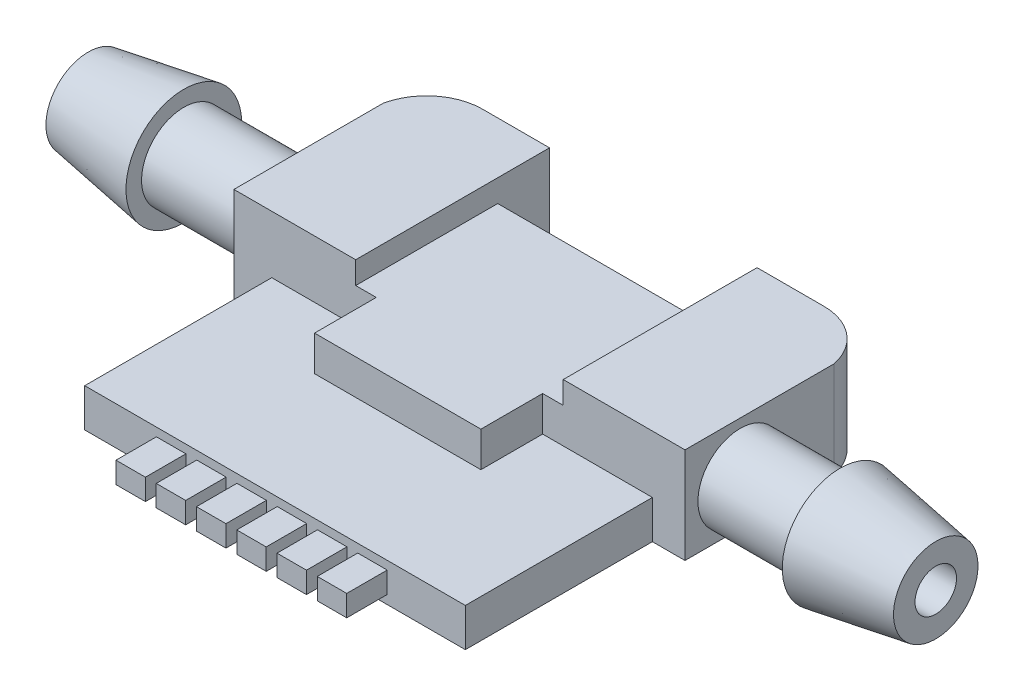
from build123d import *

# Parameters (mm, degrees)
EXTRUDE_2_DEPTH     = 6
SKETCH_2_W          = 23.822154329
SKETCH_2_H          = 20.596237597
EXTRUDE_3_DEPTH     = 2.4
SKETCH_6_W          = 12.989320898
SKETCH_6_H          = 13.80541812
CUT_EXTRUDE_2_DEPTH = 1.4
SKETCH_9_R          = 1.3
CUT_EXTRUDE_3_DEPTH = 63.989512989
SKETCH_10_W         = 1.843378815
SKETCH_10_H         = 2.532293836
EXTRUDE_4_DEPTH     = 2.4
EXTRUDE_4_2_DEPTH   = 2.4
EXTRUDE_4_3_DEPTH   = 2.4
EXTRUDE_4_4_DEPTH   = 2.4
EXTRUDE_4_5_DEPTH   = 2.4
EXTRUDE_4_6_DEPTH   = 2.4
SKETCH_11_W         = 2.532293836
SKETCH_11_H         = 1.074591371
CUT_EXTRUDE_4_DEPTH = 19.4


with BuildPart() as part:
    # 草图4 → 凸台-拉伸2 (new body)
    with BuildSketch(Plane(origin=(0, 0, 0), x_dir=(1, 0, 0), z_dir=(0, 1, 0))):
        with BuildLine():
            Line((20.128677299, 33.310340592), (20.128677299, 30.069083715))
            Line((20.128677299, 30.069083715), (33.117998197, 30.069083715))
            Line((33.117998197, 30.069083715), (33.117998197, 33.310340592))
            Line((33.117998197, 33.310340592), (37.304638817, 33.310340592))
            ThreePointArc((37.304638817, 33.310340592), (39.517710804, 32.52461013), (40.739831121, 30.519246845))
            Line((40.739831121, 30.519246845), (40.739831121, 21.179817769))
            Line((40.739831121, 21.179817769), (31.829801083, 21.179817769))
            Line((31.829801083, 21.179817769), (31.829801083, 17.315226428))
            Line((31.829801083, 17.315226428), (21.416874413, 17.315226428))
            Line((21.416874413, 17.315226428), (21.416874413, 21.179817769))
            Line((21.416874413, 21.179817769), (12.506844375, 21.179817769))
            Line((12.506844375, 21.179817769), (12.506844375, 30.519246845))
            ThreePointArc((12.506844375, 30.519246845), (13.728964692, 32.52461013), (15.942036679, 33.310340592))
            Line((15.942036679, 33.310340592), (20.128677299, 33.310340592))
        make_face()
    extrude(amount=EXTRUDE_2_DEPTH)

    # 草图2 → 凸台-拉伸3 (add)
    with BuildSketch(Plane(origin=(0, 0, 0), x_dir=(1, 0, 0), z_dir=(0, 1, 0))):
        with Locations((26.78772687, 19.770964917)):
            Rectangle(SKETCH_2_W, SKETCH_2_H)
    extrude(amount=EXTRUDE_3_DEPTH)

    # 草图6 → 切除-拉伸2 (cut)
    with BuildSketch(Plane(origin=(0, 6, 0), x_dir=(1, 0, 0), z_dir=(0, 1, 0))):
        with Locations((26.623337748, 23.166374655)):
            Rectangle(SKETCH_6_W, SKETCH_6_H)
    extrude(amount=-CUT_EXTRUDE_2_DEPTH, mode=Mode.SUBTRACT)


with BuildPart() as body_2:
    # 草图8 → 旋转5 (revolve)
    with BuildSketch(Plane(origin=(0, 3, 0), x_dir=(1, 0, 0), z_dir=(0, 1, 0))):
        Polygon((6.129946748, 27.063649251), (12.387902832, 27.063649251), (12.387902832, 24.420252834), (0.143941454, 24.420252834), (0.143941454, 27.063649251), (6.129946748, 28.040720085), align=None)
        Polygon((47.207623903, 28.040720085), (47.207623903, 27.063649251), (40.94966782, 27.063649251), (40.94966782, 24.420252834), (53.193629197, 24.420252834), (53.193629197, 27.063649251), align=None)
    revolve(axis=Axis((12.387902832, 3, -24.420252834), (-1, 0, 0)))


with BuildPart() as cut_extrude_3_tool:
    # 草图9 → 切除-拉伸3 (new, through all)
    with BuildSketch(Plane.ZY.offset(-0.143941454)):
        with Locations((-24.420252834, 3)):
            Circle(SKETCH_9_R)
    extrude(amount=-CUT_EXTRUDE_3_DEPTH)


with BuildPart() as part_1:
    add(part.part)

    # 切除-拉伸3: cut by cut_extrude_3_tool
    add(cut_extrude_3_tool.part, mode=Mode.SUBTRACT)


with BuildPart() as body_2_1:
    add(body_2.part)

    # 切除-拉伸3: cut by cut_extrude_3_tool
    add(cut_extrude_3_tool.part, mode=Mode.SUBTRACT)


with BuildPart() as body_3:
    # 草图10 → 凸台-拉伸4 (new body)
    with BuildSketch(Plane(origin=(0, 3, 0), x_dir=(1, 0, 0), z_dir=(0, 1, 0))):
        with Locations((22.859385876, 8.153366941)):
            Rectangle(SKETCH_10_W, SKETCH_10_H)
    extrude(amount=-EXTRUDE_4_DEPTH)


with BuildPart() as body_4:
    # 草图10 → Extrude 4 2 (new body)
    with BuildSketch(Plane(origin=(0, 3, 0), x_dir=(1, 0, 0), z_dir=(0, 1, 0))):
        with Locations((20.339385875, 8.153366941)):
            Rectangle(SKETCH_10_W, SKETCH_10_H)
    extrude(amount=-EXTRUDE_4_2_DEPTH)


with BuildPart() as body_5:
    # 草图10 → Extrude 4 3 (new body)
    with BuildSketch(Plane(origin=(0, 3, 0), x_dir=(1, 0, 0), z_dir=(0, 1, 0))):
        with Locations((25.379385876, 8.153366941)):
            Rectangle(SKETCH_10_W, SKETCH_10_H)
    extrude(amount=-EXTRUDE_4_3_DEPTH)


with BuildPart() as body_6:
    # 草图10 → Extrude 4 4 (new body)
    with BuildSketch(Plane(origin=(0, 3, 0), x_dir=(1, 0, 0), z_dir=(0, 1, 0))):
        with Locations((27.899385876, 8.153366941)):
            Rectangle(SKETCH_10_W, SKETCH_10_H)
    extrude(amount=-EXTRUDE_4_4_DEPTH)


with BuildPart() as body_7:
    # 草图10 → Extrude 4 5 (new body)
    with BuildSketch(Plane(origin=(0, 3, 0), x_dir=(1, 0, 0), z_dir=(0, 1, 0))):
        with Locations((30.419385876, 8.153366941)):
            Rectangle(SKETCH_10_W, SKETCH_10_H)
    extrude(amount=-EXTRUDE_4_5_DEPTH)


with BuildPart() as body_8:
    # 草图10 → Extrude 4 6 (new body)
    with BuildSketch(Plane(origin=(0, 3, 0), x_dir=(1, 0, 0), z_dir=(0, 1, 0))):
        with Locations((32.939385876, 8.153366941)):
            Rectangle(SKETCH_10_W, SKETCH_10_H)
    extrude(amount=-EXTRUDE_4_6_DEPTH)


with BuildPart() as cut_extrude_4_tool:
    # 草图11 → 切除-拉伸4 (new body)
    with BuildSketch(Plane.ZY.offset(-19.417696468)):
        with Locations((-8.153366941, 2.462704314)):
            Rectangle(SKETCH_11_W, SKETCH_11_H)
    extrude(amount=-CUT_EXTRUDE_4_DEPTH)


with BuildPart() as body_3_1:
    add(body_3.part)

    # 切除-拉伸4: cut by cut_extrude_4_tool
    add(cut_extrude_4_tool.part, mode=Mode.SUBTRACT)


with BuildPart() as body_4_1:
    add(body_4.part)

    # 切除-拉伸4: cut by cut_extrude_4_tool
    add(cut_extrude_4_tool.part, mode=Mode.SUBTRACT)


with BuildPart() as body_5_1:
    add(body_5.part)

    # 切除-拉伸4: cut by cut_extrude_4_tool
    add(cut_extrude_4_tool.part, mode=Mode.SUBTRACT)


with BuildPart() as body_6_1:
    add(body_6.part)

    # 切除-拉伸4: cut by cut_extrude_4_tool
    add(cut_extrude_4_tool.part, mode=Mode.SUBTRACT)


with BuildPart() as body_7_1:
    add(body_7.part)

    # 切除-拉伸4: cut by cut_extrude_4_tool
    add(cut_extrude_4_tool.part, mode=Mode.SUBTRACT)


with BuildPart() as body_8_1:
    add(body_8.part)

    # 切除-拉伸4: cut by cut_extrude_4_tool
    add(cut_extrude_4_tool.part, mode=Mode.SUBTRACT)


solid = Compound([part_1.part, body_2_1.part, body_3_1.part, body_4_1.part, body_5_1.part, body_6_1.part, body_7_1.part, body_8_1.part])
